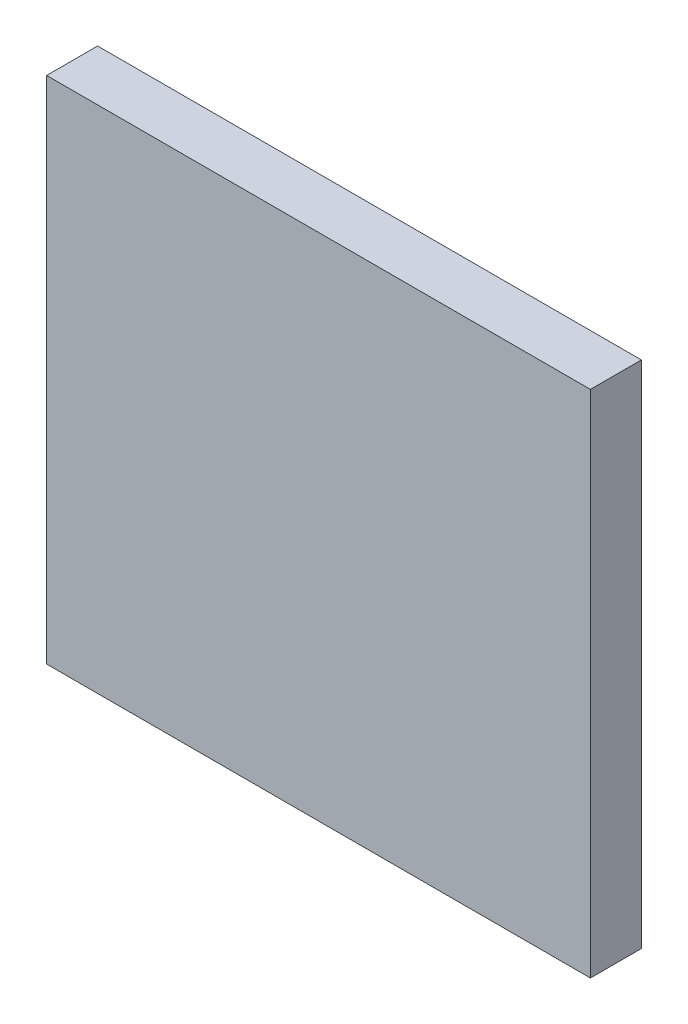
from build123d import *

# Parameters (mm, degrees)
SZKIC1_W                    = 320
SZKIC1_H                    = 300
DODANIE_WYCI_GNI_CIE1_DEPTH = 30


with BuildPart() as part:
    # Szkic1 → Dodanie-wyciągnięcie1 (new body)
    with BuildSketch(Plane.XY):
        with Locations((-150, 1660)):
            Rectangle(SZKIC1_W, SZKIC1_H)
    extrude(amount=DODANIE_WYCI_GNI_CIE1_DEPTH)


solid = part.part
